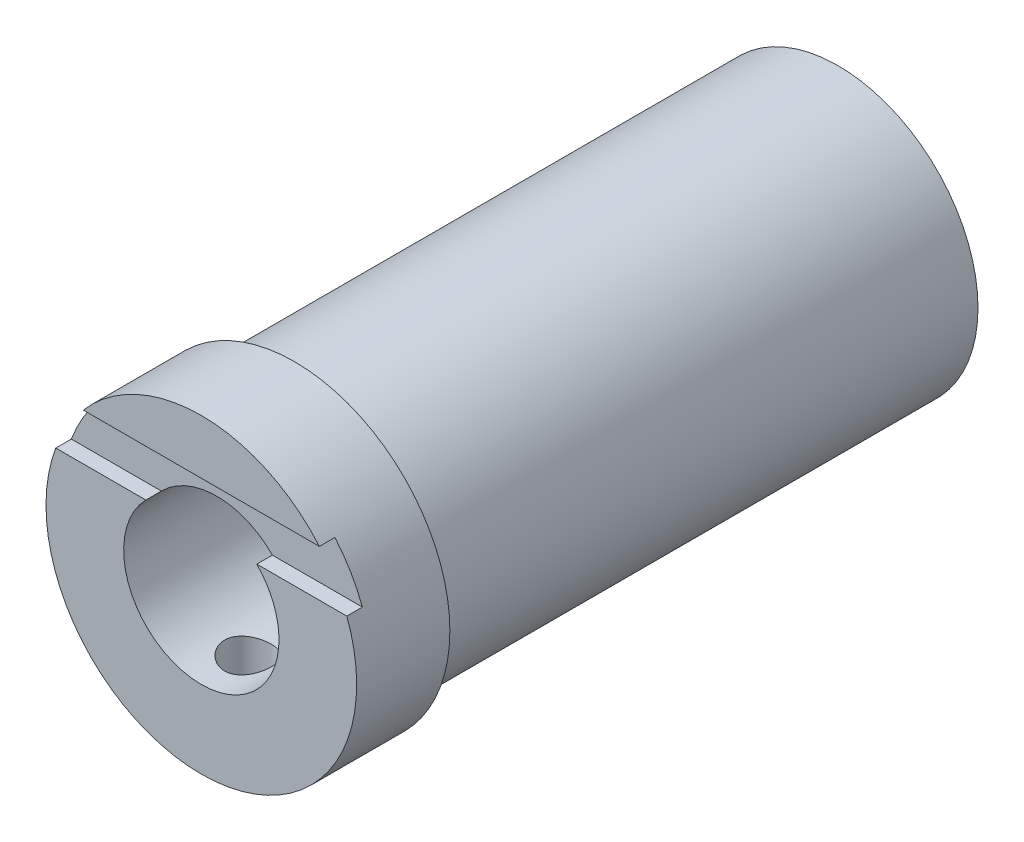
from build123d import *

# Parameters (mm, degrees)
SKETCH_1_R               = 9
SKETCH_1_R_2             = 5
EXTRUDE_1_DEPTH          = 35
SKETCH_2_R               = 10
SKETCH_2_R_2             = 5
EXTRUDE_2_DEPTH          = 6
SKETCH_3_W               = 23.145336851
SKETCH_3_H               = 3
CUT_EXTRUDE_1_DEPTH      = 1
CUT_EXTRUDE_2_REACH      = 45.37
CUT_EXTRUDE_2_END_RADIUS = 10
SKETCH_4_R               = 1.5


with BuildPart() as part:
    # Эскиз1 → Бобышка-Вытянуть1 (new body)
    with BuildSketch(Plane.XY):
        Circle(SKETCH_1_R)
        Circle(SKETCH_1_R_2, mode=Mode.SUBTRACT)
    extrude(amount=EXTRUDE_1_DEPTH)

    # Эскиз2 → Бобышка-Вытянуть2 (add)
    with BuildSketch(Plane.XY.offset(35)):
        Circle(SKETCH_2_R)
        Circle(SKETCH_2_R_2, mode=Mode.SUBTRACT)
    extrude(amount=EXTRUDE_2_DEPTH)

    # Эскиз3 → Вырез-Вытянуть1 (cut)
    with BuildSketch(Plane.XY.offset(41)):
        with Locations((0.097661358, 4.999046135)):
            Rectangle(SKETCH_3_W, SKETCH_3_H)
    extrude(amount=-CUT_EXTRUDE_1_DEPTH, mode=Mode.SUBTRACT)

    # Вырез-Вытянуть2: up to this cylinder (the profile starts inside it)
    cut_extrude_2_end = Plane(origin=(0, 0, 38), z_dir=(0, 0, -1)) * Cylinder(CUT_EXTRUDE_2_END_RADIUS, 111.74, mode=Mode.PRIVATE)
    # Эскиз4 → Вырез-Вытянуть2 (cut, up to the surface)
    with BuildSketch(Plane(origin=(0, 0, 0), x_dir=(1, 0, 0), z_dir=(0, 1, 0)), mode=Mode.PRIVATE) as cut_extrude_2_sk1:
        with Locations(Location((0, -38, 0), (0, 0, 270))):
            Circle(SKETCH_4_R)
    cut_extrude_2_tool1 = extrude(cut_extrude_2_sk1.sketch, amount=-CUT_EXTRUDE_2_REACH, mode=Mode.PRIVATE) & cut_extrude_2_end
    add(cut_extrude_2_tool1.solids().sort_by_distance((0, 0, 38))[0], mode=Mode.SUBTRACT)


solid = part.part
